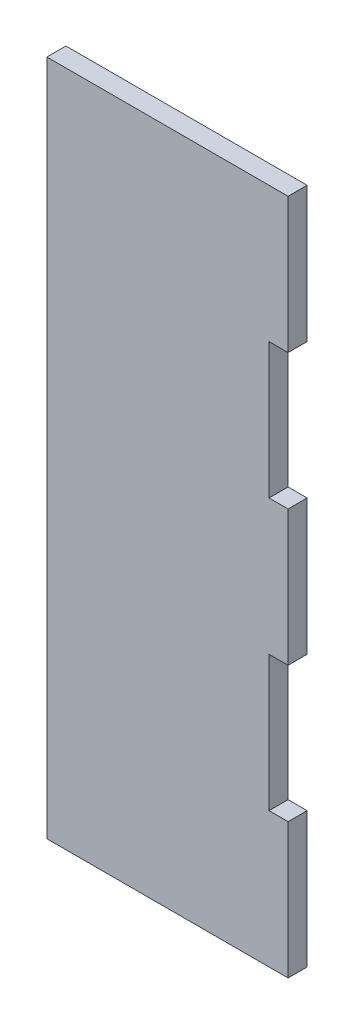
from build123d import *

# Parameters (mm, degrees)
BOSS_EXTRUDE1_DEPTH = 9


with BuildPart() as part:
    # Sketch2 → Boss-Extrude1 (new body)
    with BuildSketch(Plane.XY):
        Polygon((114, 192), (105, 192), (105, 256), (114, 256), (114, 320), (0, 320), (0, 0), (114, 0), (114, 64), (105, 64), (105, 128), (114, 128), align=None)
    extrude(amount=BOSS_EXTRUDE1_DEPTH)


solid = part.part
